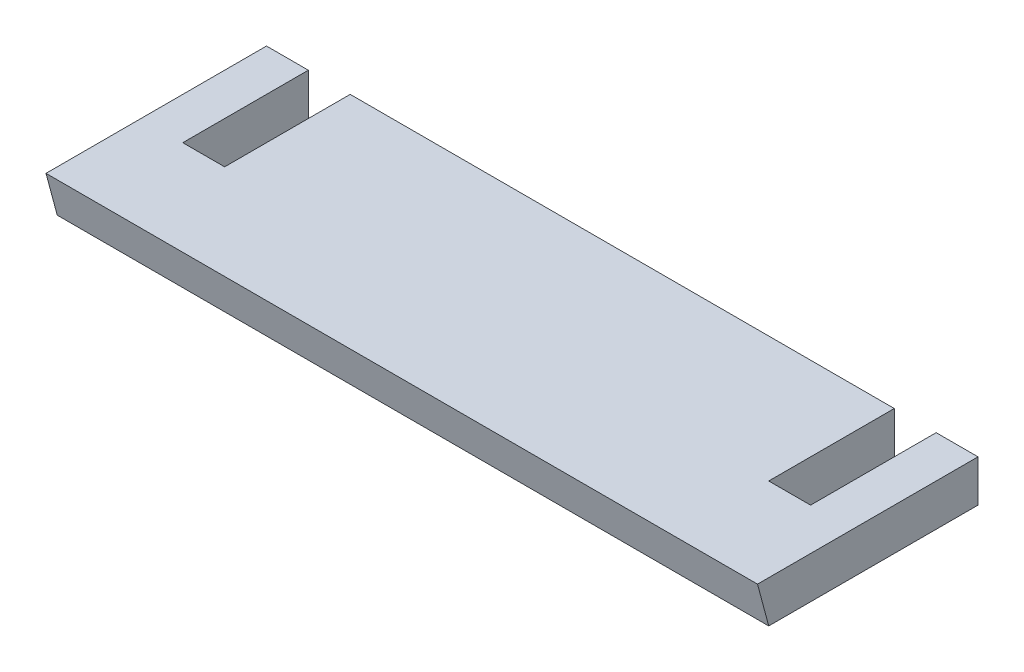
from build123d import *

# Parameters (mm, degrees)
BOSS_EXTRUDE1_DEPTH = 10
DRAFT2_ANGLE        = 15


with BuildPart() as part:
    # Sketch1 → Boss-Extrude1 (new body)
    with BuildSketch(Plane(origin=(0, 0, 0), x_dir=(1, 0, 0), z_dir=(0, 1, 0))):
        Polygon((-75, 25), (-75, -5), (-65, -5), (-65, 25), (65, 25), (65, -5), (75, -5), (75, 25), (85, 25), (85, -25), (-85, -25), (-85, 25), align=None)
    extrude(amount=BOSS_EXTRUDE1_DEPTH)

    # Draft2
    draft2_faces = [part.faces().sort_by_distance(p)[0] for p in [
        (0, 5, 25),
    ]]
    draft(draft2_faces, Plane(origin=(0, 0, 0), x_dir=(0, 0, -1), z_dir=(0, -1, 0)), DRAFT2_ANGLE)


solid = part.part
